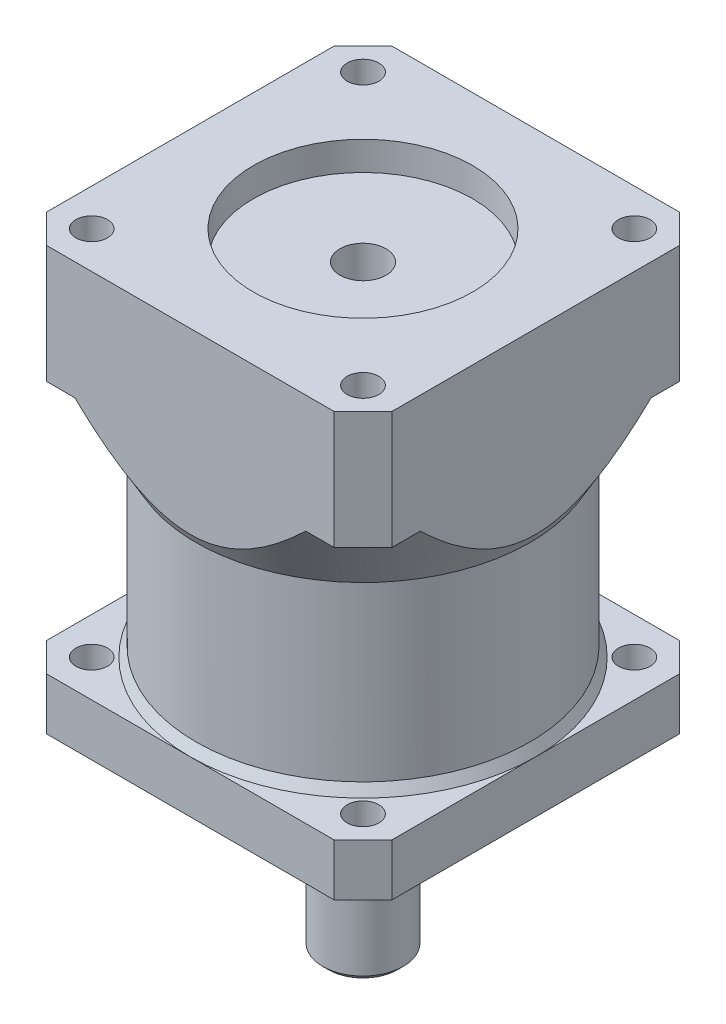
from build123d import *

# Parameters (mm, degrees)
SZKIC1_W                     = 60
SZKIC1_H                     = 60
DODANIE_WYCI_GNI_CIE1_DEPTH  = 36.75
SFAZOWANIE1_SIZE             = 5
SFAZOWANIE2_SIZE             = 1
OTW_R_POD_RUB_M51_AT_2_COUNT = 2
OTW_R_POD_RUB_M51_AT_2_PITCH = 47.14
OTW_R_POD_RUB_M51_AT_3_COUNT = 2
OTW_R_POD_RUB_M51_AT_3_PITCH = 66.66602733
OTW_R_POD_RUB_M51_AT_4_COUNT = 2
OTW_R_POD_RUB_M51_AT_4_PITCH = 47.14


with BuildPart() as part:
    # Szkic1 → Dodanie-wyciągnięcie1 (new, symmetric)
    with BuildSketch(Plane(origin=(0, 0, 0), x_dir=(1, 0, 0), z_dir=(0, 1, 0))):
        Rectangle(SZKIC1_W, SZKIC1_H)
    extrude(amount=DODANIE_WYCI_GNI_CIE1_DEPTH, both=True)

    # Szkic2 → Wycięcie-obrót1 (revolve, cut)
    with BuildSketch(Plane.XY, mode=Mode.PRIVATE) as wyci_cie_obr_t1_sk:
        Polygon((29, 4.017949192), (30, 5.75), (36.080330081, 16.281440627), (59, 16.281440627), (59, -27.714101615), (30, -27.714101615), (29, -25.982050808), align=None)
    revolve(wyci_cie_obr_t1_sk.sketch.rotate(Axis((0, 0, 0), (0, 1, 0)), 90), axis=Axis((0, 0, 0), (0, 1, 0)), mode=Mode.SUBTRACT)

    # Sfazowanie1
    sfazowanie1_edges = [part.edges().sort_by_distance(p)[0] for p in [
        (30, -32.232050808, 30),
        (-30, -32.232050808, 30),
        (-30, -32.232050808, -30),
        (30, -32.232050808, -30),
        (30, 26.515720314, 30),
        (-30, 26.515720314, 30),
        (-30, 26.515720314, -30),
        (30, 26.515720314, -30),
    ]]
    chamfer(sfazowanie1_edges, length=SFAZOWANIE1_SIZE)

    # Szkic4 → Wycięcie-obrót3 (revolve, cut)
    with BuildSketch(Plane.XY, mode=Mode.PRIVATE) as wyci_cie_obr_t3_sk:
        Polygon((0, 36.75), (19.05, 36.75), (19.05, 31.75), (4, 31.75), (4, 16.75), (0, 16.75), align=None)
    revolve(wyci_cie_obr_t3_sk.sketch.rotate(Axis((0, 0, 0), (0, 1, 0)), 90), axis=Axis((0, 0, 0), (0, 1, 0)), mode=Mode.SUBTRACT)

    # Szkic5 → Obrót1 (revolve)
    with BuildSketch(Plane(origin=(0, 0, 0), x_dir=(0, 0, -1), z_dir=(1, 0, 0)), mode=Mode.PRIVATE) as obr_t1_sk:
        Polygon((0, -36.75), (20, -36.75), (20, -39.25), (9, -39.25), (9, -40.75), (7, -40.75), (7, -71.75), (0, -71.75), align=None)
    revolve(obr_t1_sk.sketch.rotate(Axis((0, 0, 0), (0, -1, 0)), 180), axis=Axis((0, 0, 0), (0, -1, 0)))

    # Sfazowanie2
    sfazowanie2_edges = [part.edges().sort_by_distance(p)[0] for p in [
        (0, -71.75, -7),
    ]]
    chamfer(sfazowanie2_edges, length=SFAZOWANIE2_SIZE)

    # Szkic7 → Otwór pod śrubę M51 (revolve, cut)
    with BuildSketch(Plane(origin=(23.57, -36.75, -23.57), x_dir=(0, 0, -1), z_dir=(1, 0, 0))):
        Polygon((0, 0), (0, 12.652366702), (2.75, 11), (2.75, 0), align=None)
    otw_r_pod_rub_m51 = revolve(axis=Axis((23.57, -43.1, -23.57), (0, 1, 0)), mode=Mode.SUBTRACT)

    # Otwór pod śrubę M51 at 2: Otwór pod śrubę M51 ×2
    with Locations(*[(-i * OTW_R_POD_RUB_M51_AT_2_PITCH, 0, 0) for i in range(1, OTW_R_POD_RUB_M51_AT_2_COUNT)]):
        add(otw_r_pod_rub_m51, mode=Mode.SUBTRACT)

    # Otwór pod śrubę M51 at 3: Otwór pod śrubę M51 ×2
    with Locations(*[Vector(-0.7071067811865477, 0, 0.7071067811865475) * (i * OTW_R_POD_RUB_M51_AT_3_PITCH) for i in range(1, OTW_R_POD_RUB_M51_AT_3_COUNT)]):
        add(otw_r_pod_rub_m51, mode=Mode.SUBTRACT)

    # Otwór pod śrubę M51 at 4: Otwór pod śrubę M51 ×2
    with Locations(*[(0, 0, i * OTW_R_POD_RUB_M51_AT_4_PITCH) for i in range(1, OTW_R_POD_RUB_M51_AT_4_COUNT)]):
        add(otw_r_pod_rub_m51, mode=Mode.SUBTRACT)

    # Lustro1: Otwór pod śrubę M51 across plane
    add(otw_r_pod_rub_m51.mirror(Plane.ZX), mode=Mode.SUBTRACT)

    # Lustro1 copy 1 sketch → Lustro1 copy 1 (revolve, cut)
    with BuildSketch(Plane(origin=(-23.57, 36.75, -23.57), x_dir=(0, 0, -1), z_dir=(1, 0, 0))):
        Polygon((0, 0), (0, -12.652366702), (2.75, -11), (2.75, 0), align=None)
    revolve(axis=Axis((-23.57, 43.1, -23.57), (0, 1, 0)), mode=Mode.SUBTRACT)

    # Lustro1 copy 2 sketch → Lustro1 copy 2 (revolve, cut)
    with BuildSketch(Plane(origin=(-23.57, 36.75, 23.57), x_dir=(0, 0, -1), z_dir=(1, 0, 0))):
        Polygon((0, 0), (0, -12.652366702), (2.75, -11), (2.75, 0), align=None)
    revolve(axis=Axis((-23.57, 43.1, 23.57), (0, 1, 0)), mode=Mode.SUBTRACT)

    # Lustro1 copy 3 sketch → Lustro1 copy 3 (revolve, cut)
    with BuildSketch(Plane(origin=(23.57, 36.75, 23.57), x_dir=(0, 0, -1), z_dir=(1, 0, 0))):
        Polygon((0, 0), (0, -12.652366702), (2.75, -11), (2.75, 0), align=None)
    revolve(axis=Axis((23.57, 43.1, 23.57), (0, 1, 0)), mode=Mode.SUBTRACT)


solid = part.part
